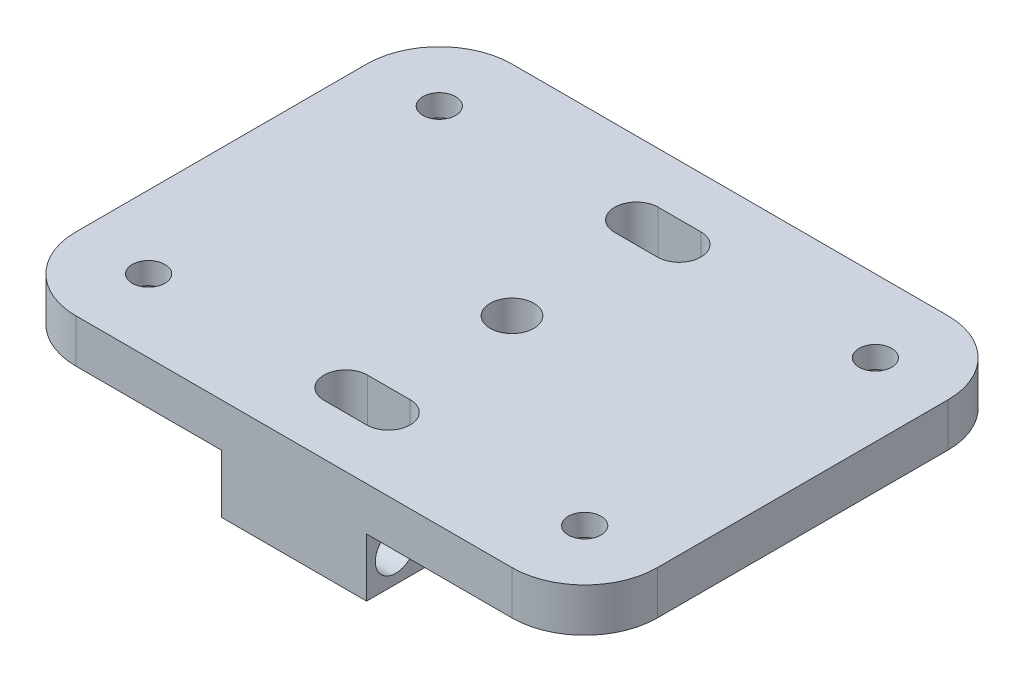
from build123d import *
from build123d.topology import SkipClean

# Parameters (mm, degrees)
ESQUISSE1_R              = 3
ESQUISSE1_R_2            = 2.25
BOSS_EXTRU_3_DEPTH       = 6
BOSS_EXTRU_4_START       = 8
ESQUISSE2_W              = 20
ESQUISSE2_H              = 60
ESQUISSE2_R              = 3
BOSS_EXTRU_4_DEPTH       = 8
ESQUISSE3_R              = 4
ENL_V_MAT_EXTRU_2_DEPTH  = 3
ESQUISSE7_R              = 2.8
ENL_V_MAT_EXTRU_8_DEPTH  = 8.1
ENL_V_MAT_EXTRU_9_DEPTH  = 52.923019943
ESQUISSE9_R              = 2.8
ENL_V_MAT_EXTRU_10_DEPTH = 8.1


with BuildPart() as part:
    # Esquisse1 → Boss.-Extru.3 (new body)
    with BuildSketch(Plane(origin=(0, 0, 0), x_dir=(1, 0, 0), z_dir=(0, 1, 0))):
        with BuildLine():
            ThreePointArc((30, 30), (37.071067812, 27.071067812), (40, 20))
            Line((40, 20), (40, -20))
            ThreePointArc((40, -20), (37.071067812, -27.071067812), (30, -30))
            Line((30, -30), (-30, -30))
            ThreePointArc((-30, -30), (-37.071067812, -27.071067812), (-40, -20))
            Line((-40, -20), (-40, 20))
            ThreePointArc((-40, 20), (-37.071067812, 27.071067812), (-30, 30))
            Line((-30, 30), (30, 30))
        make_face()
        with Locations(Location((0, 0, 0), (0, 0, 270))):
            Circle(ESQUISSE1_R, mode=Mode.SUBTRACT)
        with Locations(Location((30, -20, 0), (0, 0, 270))):
            Circle(ESQUISSE1_R_2, mode=Mode.SUBTRACT)
        with Locations(Location((-30, -20, 0), (0, 0, 270))):
            Circle(ESQUISSE1_R_2, mode=Mode.SUBTRACT)
        with Locations(Location((30, 20, 0), (0, 0, 270))):
            Circle(ESQUISSE1_R_2, mode=Mode.SUBTRACT)
        with Locations(Location((-30, 20, 0), (0, 0, 270))):
            Circle(ESQUISSE1_R_2, mode=Mode.SUBTRACT)
    extrude(amount=BOSS_EXTRU_3_DEPTH)

    # Esquisse2 → Boss.-Extru.4 (add)
    with SkipClean():  # the faces are left unmerged after this step: merging them gives an invalid solid
        with BuildSketch(Plane.XZ.offset(BOSS_EXTRU_4_START)):
            Rectangle(ESQUISSE2_W, ESQUISSE2_H)
            with Locations(Location((0, 0, 0), (0, 0, 270))):
                Circle(ESQUISSE2_R, mode=Mode.SUBTRACT)
        extrude(amount=-BOSS_EXTRU_4_DEPTH)

    # Esquisse3 → Enlèv. mat.-Extru.2 (cut)
    with SkipClean():  # the faces are left unmerged after this step: merging them gives an invalid solid
        with BuildSketch(Plane.XZ):
            with Locations(Location((-30, 20, 0), (0, 0, 270))):
                Circle(ESQUISSE3_R)
            with Locations(Location((-30, -20, 0), (0, 0, 270))):
                Circle(ESQUISSE3_R)
            with Locations(Location((30, 20, 0), (0, 0, 270))):
                Circle(ESQUISSE3_R)
            with Locations(Location((30, -20, 0), (0, 0, 270))):
                Circle(ESQUISSE3_R)
        extrude(amount=-ENL_V_MAT_EXTRU_2_DEPTH, mode=Mode.SUBTRACT)

    # Esquisse7 → Enlèv. mat.-Extru.8 (cut)
    with SkipClean():  # the faces are left unmerged after this step: merging them gives an invalid solid
        with BuildSketch(Plane.ZY.offset(10)):
            with Locations((26, -3.87740141)):
                Circle(ESQUISSE7_R)
            with Locations((-26, -3.87740141)):
                Circle(ESQUISSE7_R)
        extrude(amount=-ENL_V_MAT_EXTRU_8_DEPTH, mode=Mode.SUBTRACT)

    # Esquisse8 → Enlèv. mat.-Extru.9 (cut, through all)
    with SkipClean():  # the faces are left unmerged after this step: merging them gives an invalid solid
        with BuildSketch(Plane.XZ.offset(8)):
            with BuildLine():
                Line((-2.879526134, 23), (3, 23))
                ThreePointArc((3, 23), (6, 20), (3, 17))
                Line((3, 17), (-2.879526134, 17))
                ThreePointArc((-2.879526134, 17), (-5.879526134, 20), (-2.879526134, 23))
            make_face()
            with BuildLine():
                Line((-2.879526134, -17), (3, -17))
                ThreePointArc((3, -17), (6, -20), (3, -23))
                Line((3, -23), (-2.879526134, -23))
                ThreePointArc((-2.879526134, -23), (-5.879526134, -20), (-2.879526134, -17))
            make_face()
        extrude(amount=-ENL_V_MAT_EXTRU_9_DEPTH, mode=Mode.SUBTRACT)

    # Esquisse9 → Enlèv. mat.-Extru.10 (cut)
    with SkipClean():  # the faces are left unmerged after this step: merging them gives an invalid solid
        with BuildSketch(Plane(origin=(10, 0, 0), x_dir=(0, 0, -1), z_dir=(1, 0, 0))):
            with Locations((-26, -3.88)):
                Circle(ESQUISSE9_R)
            with Locations((26, -3.88)):
                Circle(ESQUISSE9_R)
        extrude(amount=-ENL_V_MAT_EXTRU_10_DEPTH, mode=Mode.SUBTRACT)


solid = part.part
